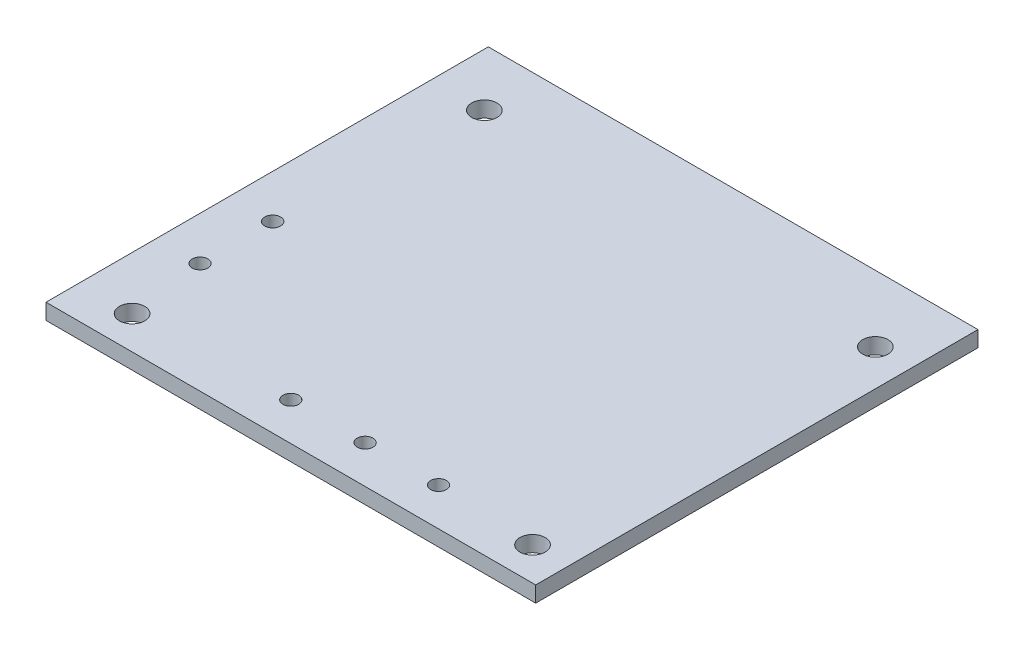
from build123d import *

# Parameters (mm, degrees)
SKETCH_1_W          = 62
SKETCH_1_H          = 56
EXTRUDE_1_DEPTH     = 2
SKETCH_2_R          = 1.6
CUT_EXTRUDE_1_DEPTH = 2
SKETCH_3_R          = 1
CUT_EXTRUDE_2_DEPTH = 84.570329663


with BuildPart() as part:
    # Эскиз1 → Бобышка-Вытянуть1 (new body)
    with BuildSketch(Plane(origin=(0, 0, 0), x_dir=(1, 0, 0), z_dir=(0, 1, 0))):
        with Locations((31, -28)):
            Rectangle(SKETCH_1_W, SKETCH_1_H)
    extrude(amount=EXTRUDE_1_DEPTH)

    # Эскиз2 → Вырез-Вытянуть1 (cut)
    with BuildSketch(Plane(origin=(0, 2, 0), x_dir=(1, 0, 0), z_dir=(0, 1, 0))):
        with Locations(Location((6.7, -7.2, 0), (0, 0, 270))):
            Circle(SKETCH_2_R)
        with Locations(Location((6.7, -51.8, 0), (0, 0, 270))):
            Circle(SKETCH_2_R)
        with Locations(Location((57.4, -51.8, 0), (0, 0, 270))):
            Circle(SKETCH_2_R)
        with Locations(Location((57.4, -8.4, 0), (0, 0, 270))):
            Circle(SKETCH_2_R)
    extrude(amount=-CUT_EXTRUDE_1_DEPTH, mode=Mode.SUBTRACT)

    # Эскиз3 → Вырез-Вытянуть2 (cut, through all)
    with BuildSketch(Plane(origin=(0, 2, 0), x_dir=(1, 0, 0), z_dir=(0, 1, 0))):
        with Locations(Location((5.5, -32.8, 0), (0, 0, 270))):
            Circle(SKETCH_3_R)
        with Locations(Location((5.5, -42, 0), (0, 0, 270))):
            Circle(SKETCH_3_R)
        with Locations(Location((26.2, -51.2, 0), (0, 0, 270))):
            Circle(SKETCH_3_R)
        with Locations(Location((35.6, -51.2, 0), (0, 0, 270))):
            Circle(SKETCH_3_R)
        with Locations(Location((44.9, -51.2, 0), (0, 0, 270))):
            Circle(SKETCH_3_R)
    extrude(amount=-CUT_EXTRUDE_2_DEPTH, mode=Mode.SUBTRACT)


solid = part.part
